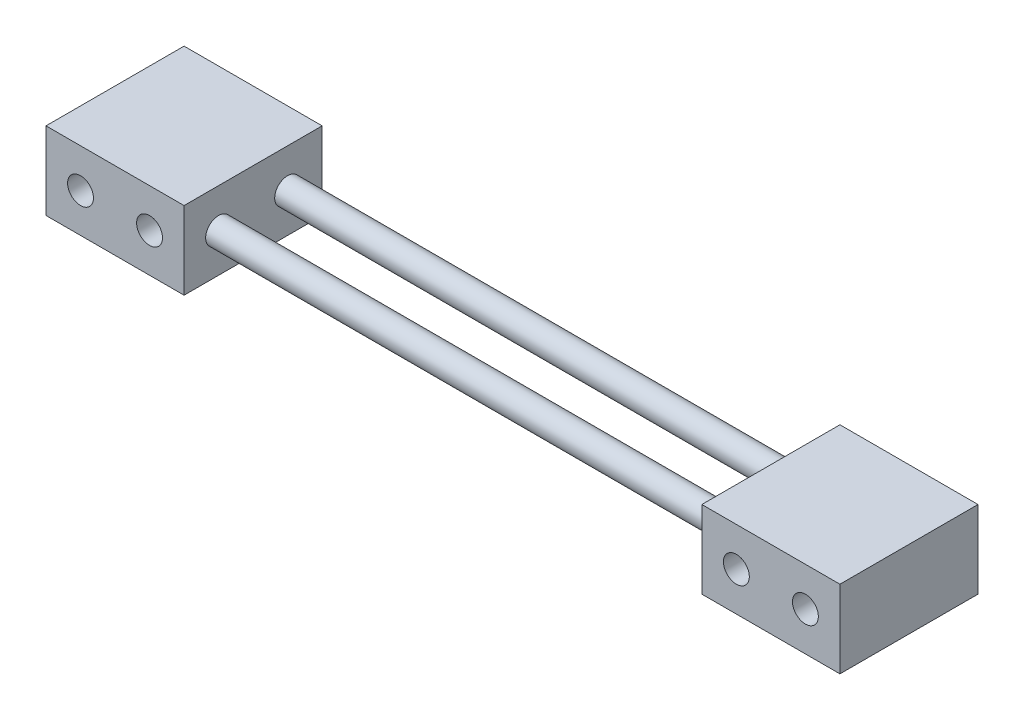
from build123d import *

# Parameters (mm, degrees)
SKETCH1_W           = 80
SKETCH1_H           = 80
BOSS_EXTRUDE1_DEPTH = 45
SKETCH2_R           = 7.5
CUT_EXTRUDE1_DEPTH  = 122.757956619
SKETCH3_R           = 7.5
BOSS_EXTRUDE2_DEPTH = 300


with BuildPart() as part:
    # Sketch1 → Boss-Extrude1 (new body)
    with BuildSketch(Plane(origin=(0, 0, 0), x_dir=(1, 0, 0), z_dir=(0, 1, 0))):
        with Locations((-40, 40)):
            Rectangle(SKETCH1_W, SKETCH1_H)
    boss_extrude1 = extrude(amount=BOSS_EXTRUDE1_DEPTH)

    # Sketch2 → Cut-Extrude1 (cut, through all)
    with BuildSketch(Plane.XY):
        with Locations((-60, 22.5)):
            Circle(SKETCH2_R)
        with Locations((-20, 22.5)):
            Circle(SKETCH2_R)
    cut_extrude1 = extrude(amount=-CUT_EXTRUDE1_DEPTH, mode=Mode.SUBTRACT)

    # Sketch3 → Boss-Extrude2 (add)
    with BuildSketch(Plane(origin=(0, 0, 0), x_dir=(0, 0, -1), z_dir=(1, 0, 0))):
        with Locations(Location((20, 22.5, 0), (0, 0, 180))):
            Circle(SKETCH3_R)
        with Locations(Location((60, 22.5, 0), (0, 0, 180))):
            Circle(SKETCH3_R)
    extrude(amount=BOSS_EXTRUDE2_DEPTH)

    # Mirror3: Boss-Extrude1, Cut-Extrude1 across plane
    add(boss_extrude1.mirror(Plane(origin=(150, 0, 0), x_dir=(0, 0, 1), z_dir=(1, 0, 0))))
    add(cut_extrude1.mirror(Plane(origin=(150, 0, 0), x_dir=(0, 0, 1), z_dir=(1, 0, 0))), mode=Mode.SUBTRACT)


solid = part.part
